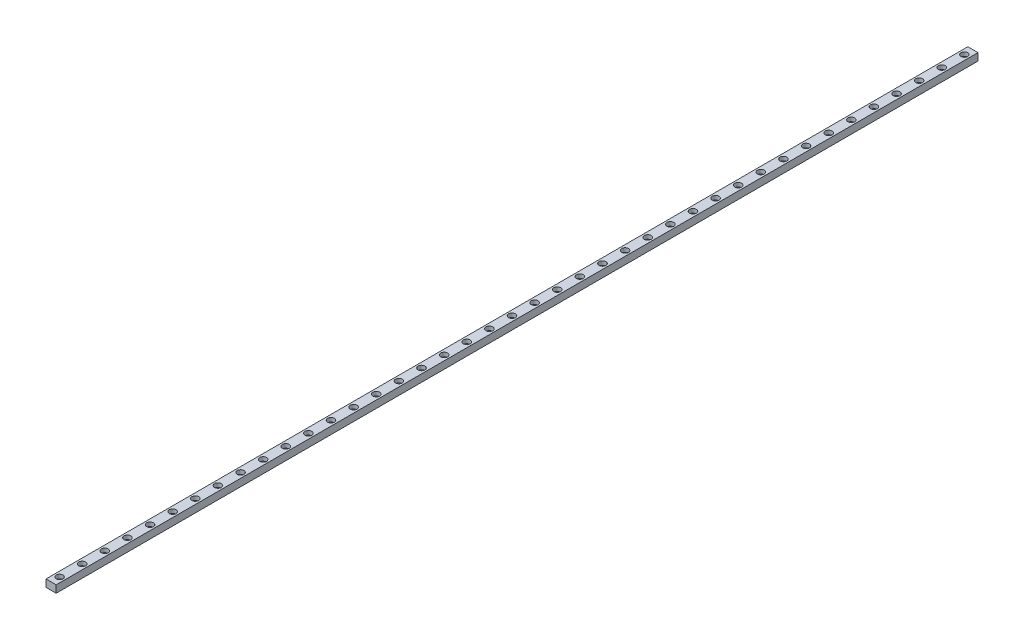
from build123d import *

# Parameters (mm, degrees)
SKETCH_1_W          = 9
SKETCH_1_H          = 6.5
EXTRUDE_1_DEPTH     = 815
SKETCH_2_R          = 1.750000006
CUT_EXTRUDE_1_DEPTH = 726.778225985
SKETCH_3_R          = 3.000000006
CUT_EXTRUDE_2_DEPTH = 3.5


with BuildPart() as part:
    # 草图1 → 凸台-拉伸1 (new body)
    with BuildSketch(Plane.XY.offset(-89.264832522)):
        Rectangle(SKETCH_1_W, SKETCH_1_H)
    extrude(amount=EXTRUDE_1_DEPTH)

    # 草图2 → 切除-拉伸1 (cut, through all)
    with BuildSketch(Plane(origin=(0, 3.25, 0), x_dir=(1, 0, 0), z_dir=(0, 1, 0))):
        with Locations(Location((0, 81.764832522, 0), (0, 0, 270))):
            Circle(SKETCH_2_R)
        with Locations(Location((0, 61.764832522, 0), (0, 0, 270))):
            Circle(SKETCH_2_R)
        with Locations(Location((0, 41.764832522, 0), (0, 0, 270))):
            Circle(SKETCH_2_R)
        with Locations(Location((0, 21.764832522, 0), (0, 0, 270))):
            Circle(SKETCH_2_R)
        with Locations(Location((0, 1.764832522, 0), (0, 0, 270))):
            Circle(SKETCH_2_R)
        with Locations(Location((0, -18.235167478, 0), (0, 0, 270))):
            Circle(SKETCH_2_R)
        with Locations(Location((0, -38.235167478, 0), (0, 0, 270))):
            Circle(SKETCH_2_R)
        with Locations(Location((0, -58.235167478, 0), (0, 0, 270))):
            Circle(SKETCH_2_R)
        with Locations(Location((0, -78.235167478, 0), (0, 0, 270))):
            Circle(SKETCH_2_R)
        with Locations(Location((0, -98.235167478, 0), (0, 0, 270))):
            Circle(SKETCH_2_R)
        with Locations(Location((0, -118.235167478, 0), (0, 0, 270))):
            Circle(SKETCH_2_R)
        with Locations(Location((0, -138.235167478, 0), (0, 0, 270))):
            Circle(SKETCH_2_R)
        with Locations(Location((0, -158.235167478, 0), (0, 0, 270))):
            Circle(SKETCH_2_R)
        with Locations(Location((0, -178.235167478, 0), (0, 0, 270))):
            Circle(SKETCH_2_R)
        with Locations(Location((0, -198.235167478, 0), (0, 0, 270))):
            Circle(SKETCH_2_R)
        with Locations(Location((0, -218.235167478, 0), (0, 0, 270))):
            Circle(SKETCH_2_R)
        with Locations(Location((0, -238.235167478, 0), (0, 0, 270))):
            Circle(SKETCH_2_R)
        with Locations(Location((0, -258.235167478, 0), (0, 0, 270))):
            Circle(SKETCH_2_R)
        with Locations(Location((0, -278.235167478, 0), (0, 0, 270))):
            Circle(SKETCH_2_R)
        with Locations(Location((0, -298.235167478, 0), (0, 0, 270))):
            Circle(SKETCH_2_R)
        with Locations(Location((0, -318.235167478, 0), (0, 0, 270))):
            Circle(SKETCH_2_R)
        with Locations(Location((0, -338.235167478, 0), (0, 0, 270))):
            Circle(SKETCH_2_R)
        with Locations(Location((0, -358.235167478, 0), (0, 0, 270))):
            Circle(SKETCH_2_R)
        with Locations(Location((0, -378.235167478, 0), (0, 0, 270))):
            Circle(SKETCH_2_R)
        with Locations(Location((0, -398.235167478, 0), (0, 0, 270))):
            Circle(SKETCH_2_R)
        with Locations(Location((0, -418.235167478, 0), (0, 0, 270))):
            Circle(SKETCH_2_R)
        with Locations(Location((0, -438.235167478, 0), (0, 0, 270))):
            Circle(SKETCH_2_R)
        with Locations(Location((0, -458.235167478, 0), (0, 0, 270))):
            Circle(SKETCH_2_R)
        with Locations(Location((0, -478.235167478, 0), (0, 0, 270))):
            Circle(SKETCH_2_R)
        with Locations(Location((0, -498.235167478, 0), (0, 0, 270))):
            Circle(SKETCH_2_R)
        with Locations(Location((0, -518.235167478, 0), (0, 0, 270))):
            Circle(SKETCH_2_R)
        with Locations(Location((0, -538.235167478, 0), (0, 0, 270))):
            Circle(SKETCH_2_R)
        with Locations(Location((0, -558.235167478, 0), (0, 0, 270))):
            Circle(SKETCH_2_R)
        with Locations(Location((0, -578.235167478, 0), (0, 0, 270))):
            Circle(SKETCH_2_R)
        with Locations(Location((0, -598.235167478, 0), (0, 0, 270))):
            Circle(SKETCH_2_R)
        with Locations(Location((0, -618.235167478, 0), (0, 0, 270))):
            Circle(SKETCH_2_R)
        with Locations(Location((0, -638.235167478, 0), (0, 0, 270))):
            Circle(SKETCH_2_R)
        with Locations(Location((0, -658.235167478, 0), (0, 0, 270))):
            Circle(SKETCH_2_R)
        with Locations(Location((0, -678.235167478, 0), (0, 0, 270))):
            Circle(SKETCH_2_R)
        with Locations(Location((0, -698.235167478, 0), (0, 0, 270))):
            Circle(SKETCH_2_R)
        with Locations(Location((0, -718.235167478, 0), (0, 0, 270))):
            Circle(SKETCH_2_R)
        with Locations((0, -738.235167478)):
            Circle(SKETCH_2_R)
        with Locations((0, -758.235167478)):
            Circle(SKETCH_2_R)
        with Locations((0, -778.235167478)):
            Circle(SKETCH_2_R)
        with Locations((0, -798.235167478)):
            Circle(SKETCH_2_R)
        with Locations((0, -818.235167478)):
            Circle(SKETCH_2_R)
        with Locations((0, -838.235167478)):
            Circle(SKETCH_2_R)
        with Locations((0, -858.235167478)):
            Circle(SKETCH_2_R)
        with Locations((0, -878.235167478)):
            Circle(SKETCH_2_R)
        with Locations((0, -898.235167478)):
            Circle(SKETCH_2_R)
        with Locations((0, -918.235167478)):
            Circle(SKETCH_2_R)
        with Locations((0, -938.235167478)):
            Circle(SKETCH_2_R)
        with Locations((0, -958.235167478)):
            Circle(SKETCH_2_R)
        with Locations((0, -978.235167478)):
            Circle(SKETCH_2_R)
        with Locations((0, -998.235167478)):
            Circle(SKETCH_2_R)
        with Locations((0, -1018.235167478)):
            Circle(SKETCH_2_R)
        with Locations((0, -1038.235167478)):
            Circle(SKETCH_2_R)
        with Locations((0, -1058.235167478)):
            Circle(SKETCH_2_R)
        with Locations((0, -1078.235167478)):
            Circle(SKETCH_2_R)
        with Locations((0, -1098.235167478)):
            Circle(SKETCH_2_R)
    extrude(amount=-CUT_EXTRUDE_1_DEPTH, mode=Mode.SUBTRACT)

    # 草图3 → 切除-拉伸2 (cut)
    with BuildSketch(Plane(origin=(0, 3.25, 0), x_dir=(1, 0, 0), z_dir=(0, 1, 0))):
        with Locations(Location((0, 81.764832522, 0), (0, 0, 270))):
            Circle(SKETCH_3_R)
        with Locations(Location((0, 61.764832522, 0), (0, 0, 270))):
            Circle(SKETCH_3_R)
        with Locations(Location((0, 41.764832522, 0), (0, 0, 270))):
            Circle(SKETCH_3_R)
        with Locations(Location((0, 21.764832522, 0), (0, 0, 270))):
            Circle(SKETCH_3_R)
        with Locations(Location((0, 1.764832522, 0), (0, 0, 270))):
            Circle(SKETCH_3_R)
        with Locations(Location((0, -18.235167478, 0), (0, 0, 270))):
            Circle(SKETCH_3_R)
        with Locations(Location((0, -38.235167478, 0), (0, 0, 270))):
            Circle(SKETCH_3_R)
        with Locations(Location((0, -58.235167478, 0), (0, 0, 270))):
            Circle(SKETCH_3_R)
        with Locations(Location((0, -78.235167478, 0), (0, 0, 270))):
            Circle(SKETCH_3_R)
        with Locations(Location((0, -98.235167478, 0), (0, 0, 270))):
            Circle(SKETCH_3_R)
        with Locations(Location((0, -118.235167478, 0), (0, 0, 270))):
            Circle(SKETCH_3_R)
        with Locations(Location((0, -138.235167478, 0), (0, 0, 270))):
            Circle(SKETCH_3_R)
        with Locations(Location((0, -158.235167478, 0), (0, 0, 270))):
            Circle(SKETCH_3_R)
        with Locations(Location((0, -178.235167478, 0), (0, 0, 270))):
            Circle(SKETCH_3_R)
        with Locations(Location((0, -198.235167478, 0), (0, 0, 270))):
            Circle(SKETCH_3_R)
        with Locations(Location((0, -218.235167478, 0), (0, 0, 270))):
            Circle(SKETCH_3_R)
        with Locations(Location((0, -238.235167478, 0), (0, 0, 270))):
            Circle(SKETCH_3_R)
        with Locations(Location((0, -258.235167478, 0), (0, 0, 270))):
            Circle(SKETCH_3_R)
        with Locations(Location((0, -278.235167478, 0), (0, 0, 270))):
            Circle(SKETCH_3_R)
        with Locations(Location((0, -298.235167478, 0), (0, 0, 270))):
            Circle(SKETCH_3_R)
        with Locations(Location((0, -318.235167478, 0), (0, 0, 270))):
            Circle(SKETCH_3_R)
        with Locations(Location((0, -338.235167478, 0), (0, 0, 270))):
            Circle(SKETCH_3_R)
        with Locations(Location((0, -358.235167478, 0), (0, 0, 270))):
            Circle(SKETCH_3_R)
        with Locations(Location((0, -378.235167478, 0), (0, 0, 270))):
            Circle(SKETCH_3_R)
        with Locations(Location((0, -398.235167478, 0), (0, 0, 270))):
            Circle(SKETCH_3_R)
        with Locations(Location((0, -418.235167478, 0), (0, 0, 270))):
            Circle(SKETCH_3_R)
        with Locations(Location((0, -438.235167478, 0), (0, 0, 270))):
            Circle(SKETCH_3_R)
        with Locations(Location((0, -458.235167478, 0), (0, 0, 270))):
            Circle(SKETCH_3_R)
        with Locations(Location((0, -478.235167478, 0), (0, 0, 270))):
            Circle(SKETCH_3_R)
        with Locations(Location((0, -498.235167478, 0), (0, 0, 270))):
            Circle(SKETCH_3_R)
        with Locations(Location((0, -518.235167478, 0), (0, 0, 270))):
            Circle(SKETCH_3_R)
        with Locations(Location((0, -538.235167478, 0), (0, 0, 270))):
            Circle(SKETCH_3_R)
        with Locations(Location((0, -558.235167478, 0), (0, 0, 270))):
            Circle(SKETCH_3_R)
        with Locations(Location((0, -578.235167478, 0), (0, 0, 270))):
            Circle(SKETCH_3_R)
        with Locations(Location((0, -598.235167478, 0), (0, 0, 270))):
            Circle(SKETCH_3_R)
        with Locations(Location((0, -618.235167478, 0), (0, 0, 270))):
            Circle(SKETCH_3_R)
        with Locations(Location((0, -638.235167478, 0), (0, 0, 270))):
            Circle(SKETCH_3_R)
        with Locations(Location((0, -658.235167478, 0), (0, 0, 270))):
            Circle(SKETCH_3_R)
        with Locations(Location((0, -678.235167478, 0), (0, 0, 270))):
            Circle(SKETCH_3_R)
        with Locations(Location((0, -698.235167478, 0), (0, 0, 270))):
            Circle(SKETCH_3_R)
        with Locations(Location((0, -718.235167478, 0), (0, 0, 270))):
            Circle(SKETCH_3_R)
        with Locations((0, -738.235167478)):
            Circle(SKETCH_3_R)
        with Locations((0, -758.235167478)):
            Circle(SKETCH_3_R)
        with Locations((0, -778.235167478)):
            Circle(SKETCH_3_R)
        with Locations((0, -798.235167478)):
            Circle(SKETCH_3_R)
        with Locations((0, -818.235167478)):
            Circle(SKETCH_3_R)
        with Locations((0, -838.235167478)):
            Circle(SKETCH_3_R)
        with Locations((0, -858.235167478)):
            Circle(SKETCH_3_R)
        with Locations((0, -878.235167478)):
            Circle(SKETCH_3_R)
        with Locations((0, -898.235167478)):
            Circle(SKETCH_3_R)
        with Locations((0, -918.235167478)):
            Circle(SKETCH_3_R)
        with Locations((0, -938.235167478)):
            Circle(SKETCH_3_R)
        with Locations((0, -958.235167478)):
            Circle(SKETCH_3_R)
        with Locations((0, -978.235167478)):
            Circle(SKETCH_3_R)
        with Locations((0, -998.235167478)):
            Circle(SKETCH_3_R)
        with Locations((0, -1018.235167478)):
            Circle(SKETCH_3_R)
        with Locations((0, -1038.235167478)):
            Circle(SKETCH_3_R)
        with Locations((0, -1058.235167478)):
            Circle(SKETCH_3_R)
        with Locations((0, -1078.235167478)):
            Circle(SKETCH_3_R)
        with Locations((0, -1098.235167478)):
            Circle(SKETCH_3_R)
    extrude(amount=-CUT_EXTRUDE_2_DEPTH, mode=Mode.SUBTRACT)


solid = part.part
